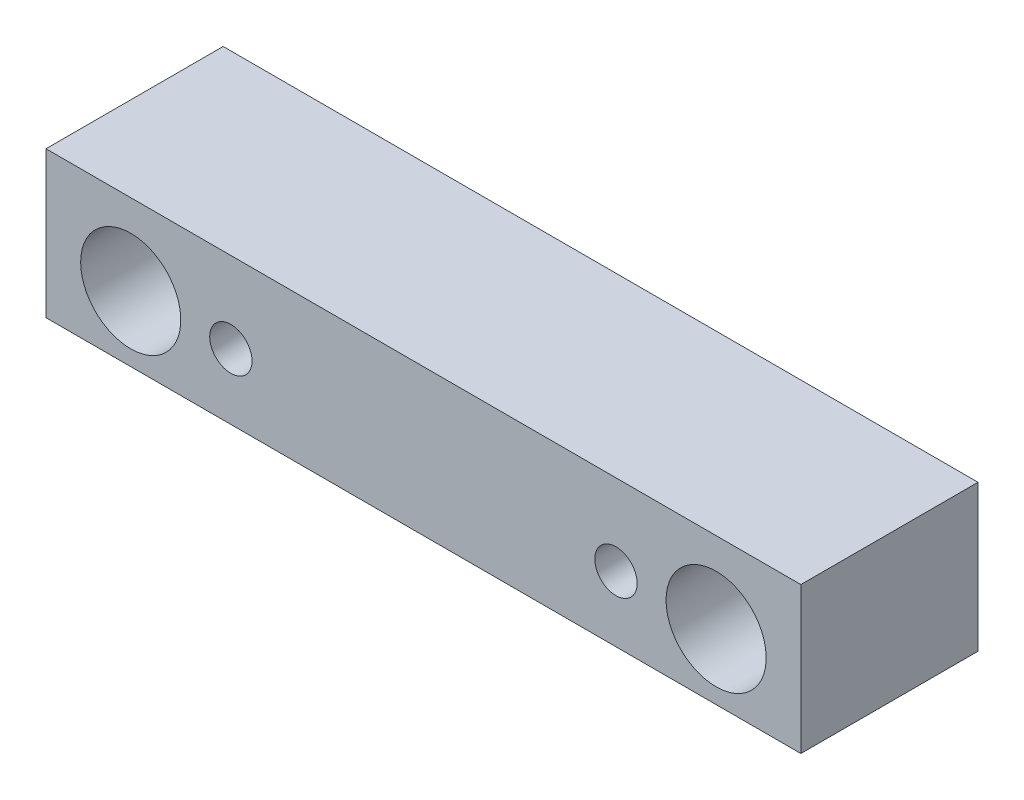
from build123d import *

# Parameters (mm, degrees)
SKETCH_1_W      = 196
SKETCH_1_H      = 38
SKETCH_1_R      = 5.499997081
SKETCH_1_R_2    = 13
EXTRUDE_1_DEPTH = 46


with BuildPart() as part:
    # Эскиз1 → Бобышка-Вытянуть1 (new body)
    with BuildSketch(Plane.XY.offset(46)):
        with Locations((0, 79)):
            Rectangle(SKETCH_1_W, SKETCH_1_H)
        with Locations(Location((-50.000002921, 76.99985459, 0), (0, 0, 180))):
            Circle(SKETCH_1_R, mode=Mode.SUBTRACT)
        with Locations(Location((49.999997079, 76.99985459, 0), (0, 0, 180))):
            Circle(SKETCH_1_R, mode=Mode.SUBTRACT)
        with Locations(Location((-76, 77, 0), (0, 0, 180))):
            Circle(SKETCH_1_R_2, mode=Mode.SUBTRACT)
        with Locations(Location((76, 77, 0), (0, 0, 180))):
            Circle(SKETCH_1_R_2, mode=Mode.SUBTRACT)
    extrude(amount=-EXTRUDE_1_DEPTH)


solid = part.part
